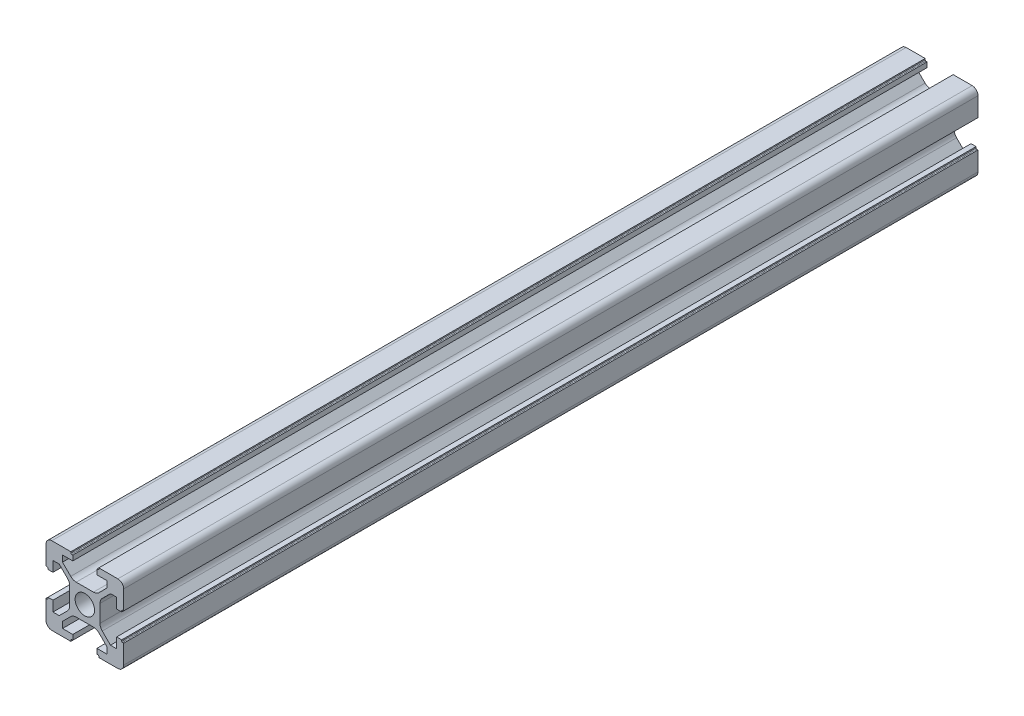
from build123d import *

# Parameters (mm, degrees)
CROQUIS1_R              = 2.5
SALIENTE_EXTRUIR1_DEPTH = 110


with BuildPart() as part:
    # Croquis1 → Saliente-Extruir1 (new, symmetric)
    with BuildSketch(Plane.XY):
        with BuildLine():
            Line((-4.485786438, -3.6372583), (-6.6, -5.751471863))
            Line((-6.6, -5.751471863), (-8.2, -5.751471863))
            Line((-8.2, -5.751471863), (-8.2, -3.1))
            Line((-8.2, -3.1), (-9.5, -3.1))
            Line((-9.5, -3.1), (-9.5, -3.4))
            ThreePointArc((-9.5, -3.4), (-9.558578644, -3.541421356), (-9.7, -3.6))
            Line((-9.7, -3.6), (-10, -3.6))
            Line((-10, -3.6), (-10, -8.5))
            ThreePointArc((-10, -8.5), (-9.560660172, -9.560660172), (-8.5, -10))
            Line((-8.5, -10), (-3.6, -10))
            Line((-3.6, -10), (-3.6, -9.7))
            ThreePointArc((-3.6, -9.7), (-3.541421356, -9.558578644), (-3.4, -9.5))
            Line((-3.4, -9.5), (-3.1, -9.5))
            Line((-3.1, -9.5), (-3.1, -8.2))
            Line((-3.1, -8.2), (-5.751471863, -8.2))
            Line((-5.751471863, -8.2), (-5.751471863, -6.6))
            Line((-5.751471863, -6.6), (-3.6372583, -4.485786438))
            ThreePointArc((-3.6372583, -4.485786438), (-2.988411603, -4.052240935), (-2.223044738, -3.9))
            Line((-2.223044738, -3.9), (2.223044738, -3.9))
            ThreePointArc((2.223044738, -3.9), (2.988411603, -4.052240935), (3.6372583, -4.485786438))
            Line((3.6372583, -4.485786438), (5.751471863, -6.6))
            Line((5.751471863, -6.6), (5.751471863, -8.2))
            Line((5.751471863, -8.2), (3.1, -8.2))
            Line((3.1, -8.2), (3.1, -9.5))
            Line((3.1, -9.5), (3.4, -9.5))
            ThreePointArc((3.4, -9.5), (3.541421356, -9.558578644), (3.6, -9.7))
            Line((3.6, -9.7), (3.6, -10))
            Line((3.6, -10), (8.5, -10))
            ThreePointArc((8.5, -10), (9.560660172, -9.560660172), (10, -8.5))
            Line((10, -8.5), (10, -3.6))
            Line((10, -3.6), (9.7, -3.6))
            ThreePointArc((9.7, -3.6), (9.558578644, -3.541421356), (9.5, -3.4))
            Line((9.5, -3.4), (9.5, -3.1))
            Line((9.5, -3.1), (8.2, -3.1))
            Line((8.2, -3.1), (8.2, -5.751471863))
            Line((8.2, -5.751471863), (6.6, -5.751471863))
            Line((6.6, -5.751471863), (4.485786438, -3.6372583))
            ThreePointArc((4.485786438, -3.6372583), (4.052240935, -2.988411603), (3.9, -2.223044738))
            Line((3.9, -2.223044738), (3.9, 2.223044738))
            ThreePointArc((3.9, 2.223044738), (4.052240935, 2.988411603), (4.485786438, 3.6372583))
            Line((4.485786438, 3.6372583), (6.6, 5.751471863))
            Line((6.6, 5.751471863), (8.2, 5.751471863))
            Line((8.2, 5.751471863), (8.2, 3.1))
            Line((8.2, 3.1), (9.5, 3.1))
            Line((9.5, 3.1), (9.5, 3.4))
            ThreePointArc((9.5, 3.4), (9.558578644, 3.541421356), (9.7, 3.6))
            Line((9.7, 3.6), (10, 3.6))
            Line((10, 3.6), (10, 8.5))
            ThreePointArc((10, 8.5), (9.560660172, 9.560660172), (8.5, 10))
            Line((8.5, 10), (3.6, 10))
            Line((3.6, 10), (3.6, 9.7))
            ThreePointArc((3.6, 9.7), (3.541421356, 9.558578644), (3.4, 9.5))
            Line((3.4, 9.5), (3.1, 9.5))
            Line((3.1, 9.5), (3.1, 8.2))
            Line((3.1, 8.2), (5.751471863, 8.2))
            Line((5.751471863, 8.2), (5.751471863, 6.6))
            Line((5.751471863, 6.6), (3.6372583, 4.485786438))
            ThreePointArc((3.6372583, 4.485786438), (2.988411603, 4.052240935), (2.223044738, 3.9))
            Line((2.223044738, 3.9), (-2.223044738, 3.9))
            ThreePointArc((-2.223044738, 3.9), (-2.988411603, 4.052240935), (-3.6372583, 4.485786438))
            Line((-3.6372583, 4.485786438), (-5.751471863, 6.6))
            Line((-5.751471863, 6.6), (-5.751471863, 8.2))
            Line((-5.751471863, 8.2), (-3.1, 8.2))
            Line((-3.1, 8.2), (-3.1, 9.5))
            Line((-3.1, 9.5), (-3.4, 9.5))
            ThreePointArc((-3.4, 9.5), (-3.541421356, 9.558578644), (-3.6, 9.7))
            Line((-3.6, 9.7), (-3.6, 10))
            Line((-3.6, 10), (-8.5, 10))
            ThreePointArc((-8.5, 10), (-9.560660172, 9.560660172), (-10, 8.5))
            Line((-10, 8.5), (-10, 3.6))
            Line((-10, 3.6), (-9.7, 3.6))
            ThreePointArc((-9.7, 3.6), (-9.558578644, 3.541421356), (-9.5, 3.4))
            Line((-9.5, 3.4), (-9.5, 3.1))
            Line((-9.5, 3.1), (-8.2, 3.1))
            Line((-8.2, 3.1), (-8.2, 5.751471863))
            Line((-8.2, 5.751471863), (-6.6, 5.751471863))
            Line((-6.6, 5.751471863), (-4.485786438, 3.6372583))
            ThreePointArc((-4.485786438, 3.6372583), (-4.052240935, 2.988411603), (-3.9, 2.223044738))
            Line((-3.9, 2.223044738), (-3.9, -2.223044738))
            ThreePointArc((-3.9, -2.223044738), (-4.052240935, -2.988411603), (-4.485786438, -3.6372583))
        make_face()
        Circle(CROQUIS1_R, mode=Mode.SUBTRACT)
    extrude(amount=SALIENTE_EXTRUIR1_DEPTH, both=True)


solid = part.part
